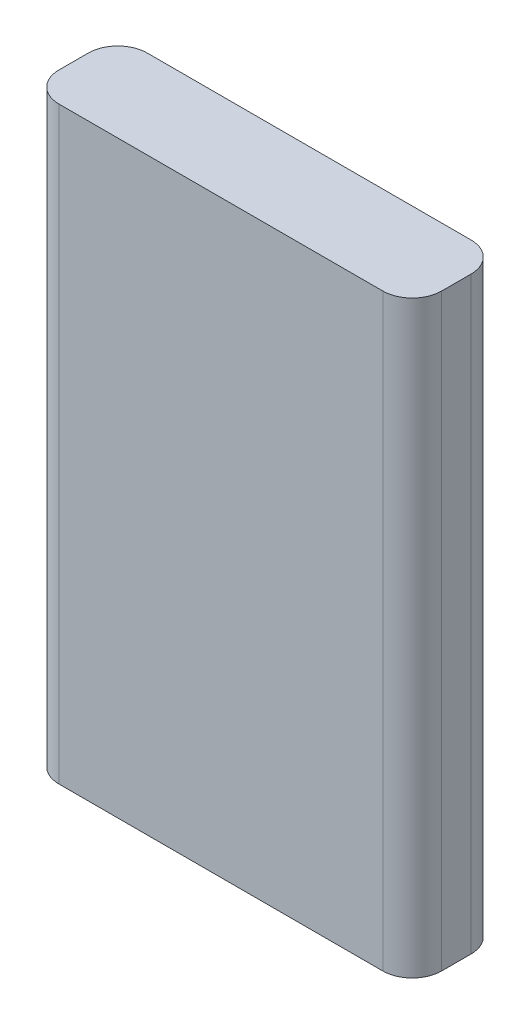
from build123d import *

# Parameters (mm, degrees)
CROQUIS1_W              = 13
CROQUIS1_H              = 20
SALIENTE_EXTRUIR1_DEPTH = 3
REDONDEO1_R             = 1


with BuildPart() as part:
    # Croquis1 → Saliente-Extruir1 (new body)
    with BuildSketch(Plane.XY):
        with Locations((-13.144970414, -0.177514793)):
            Rectangle(CROQUIS1_W, CROQUIS1_H)
    extrude(amount=SALIENTE_EXTRUIR1_DEPTH)

    # Redondeo1
    redondeo1_edges = [part.edges().sort_by_distance(p)[0] for p in [
        (-6.644970414, -0.177514793, 3),
        (-19.644970414, -0.177514793, 3),
        (-6.644970414, -0.177514793, 0),
        (-19.644970414, -0.177514793, 0),
    ]]
    fillet(redondeo1_edges, radius=REDONDEO1_R)


solid = part.part
